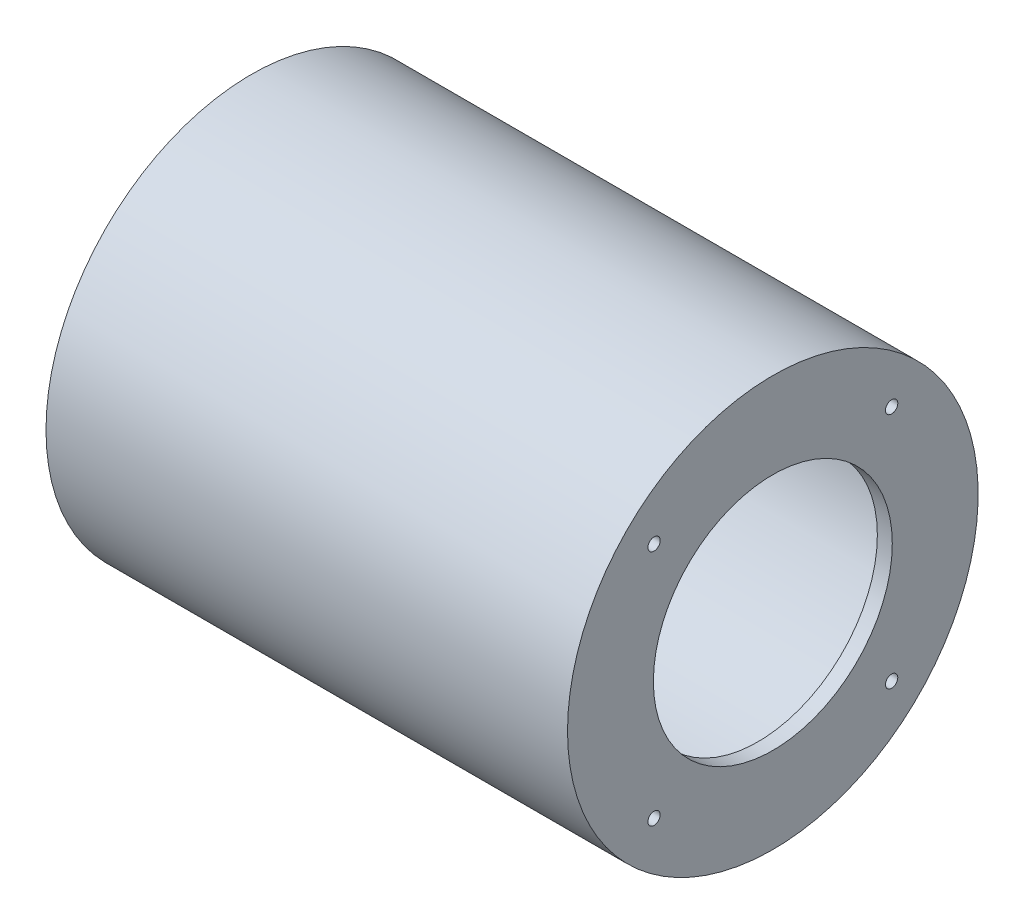
from build123d import *

# Parameters (mm, degrees)
AXIAL_START        = 9.7
SKETCH2_R          = 1.65
AXIAL_HOLES_DEPTH  = 4
CUT_EXTRUDE2_START = -126
SKETCH3_R          = 1.25
CUT_EXTRUDE2_DEPTH = 6


with BuildPart() as part:
    # Axial profile (mm) → Full revolution (revolve)
    with BuildSketch(Plane.XY, mode=Mode.PRIVATE) as full_revolution_sk:
        Polygon((-126, 49), (9.7, 49), (9.7, 32), (13.7, 32), (13.7, 55), (-126, 55), align=None)
    revolve(full_revolution_sk.sketch.rotate(Axis((-110, 0, 0), (1, 0, 0)), 90), axis=Axis((-110, 0, 0), (1, 0, 0)))

    # Sketch2 → Axial holes (cut)
    with BuildSketch(Plane(origin=(0, 0, 0), x_dir=(0, 0, -1), z_dir=(1, 0, 0)).offset(AXIAL_START)):
        with Locations((-31.819805153, 31.819805153)):
            Circle(SKETCH2_R)
        with Locations((-31.819805153, -31.819805153)):
            Circle(SKETCH2_R)
        with Locations((31.819805153, -31.819805153)):
            Circle(SKETCH2_R)
        with Locations((31.819805153, 31.819805153)):
            Circle(SKETCH2_R)
    extrude(amount=AXIAL_HOLES_DEPTH, mode=Mode.SUBTRACT)

    # Sketch3 → Cut-Extrude2 (cut)
    with BuildSketch(Plane(origin=(0, 0, 0), x_dir=(0, 0, -1), z_dir=(1, 0, 0)).offset(CUT_EXTRUDE2_START)):
        with Locations((0, 52)):
            Circle(SKETCH3_R)
        with Locations((-52, 0)):
            Circle(SKETCH3_R)
        with Locations((0, -52)):
            Circle(SKETCH3_R)
        with Locations((52, 0)):
            Circle(SKETCH3_R)
    extrude(amount=CUT_EXTRUDE2_DEPTH, mode=Mode.SUBTRACT)


solid = part.part
